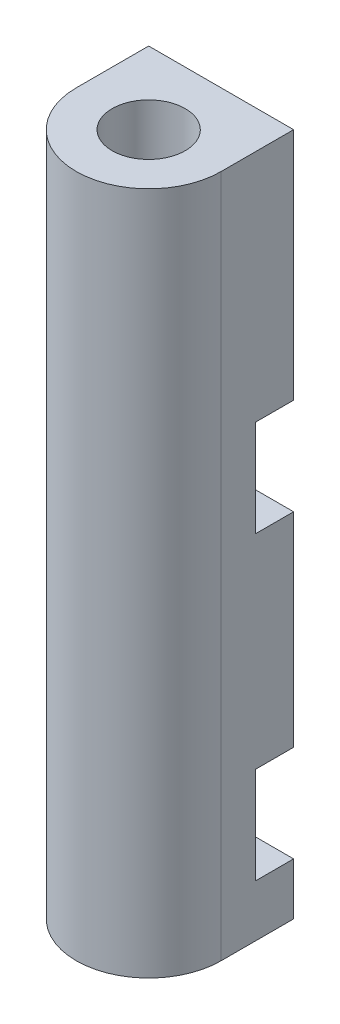
from build123d import *

# Parameters (mm, degrees)
SKETCH1_R           = 3.025
BOSS_EXTRUDE1_DEPTH = 56.6
SKETCH2_W           = 8
SKETCH2_H           = 8
CUT_EXTRUDE1_DEPTH  = 3.175


with BuildPart() as part:
    # Sketch1 → Boss-Extrude1 (new body)
    with BuildSketch(Plane(origin=(0, 0, 0), x_dir=(1, 0, 0), z_dir=(0, 1, 0))):
        with BuildLine():
            Line((-6, 0), (-6, 5.43))
            Line((-6, 5.43), (-6, 6))
            Line((-6, 6), (6, 6))
            Line((6, 6), (6, 5.43))
            Line((6, 5.43), (6, 0))
            ThreePointArc((6, 0), (0, -6), (-6, 0))
        make_face()
        with Locations(Location((0, 0, 0), (0, 0, 90))):
            Circle(SKETCH1_R, mode=Mode.SUBTRACT)
    extrude(amount=BOSS_EXTRUDE1_DEPTH)

    # Sketch2 → Cut-Extrude1 (cut)
    with BuildSketch(Plane(origin=(0, 0, -6), x_dir=(-1, 0, 0), z_dir=(0, 0, -1))):
        with Locations((-3.669604029, 8.307999034)):
            Rectangle(SKETCH2_W, SKETCH2_H)
        with Locations((-3.669606205, 33.199999034)):
            Rectangle(SKETCH2_W, SKETCH2_H)
    extrude(amount=-CUT_EXTRUDE1_DEPTH, mode=Mode.SUBTRACT)


solid = part.part
